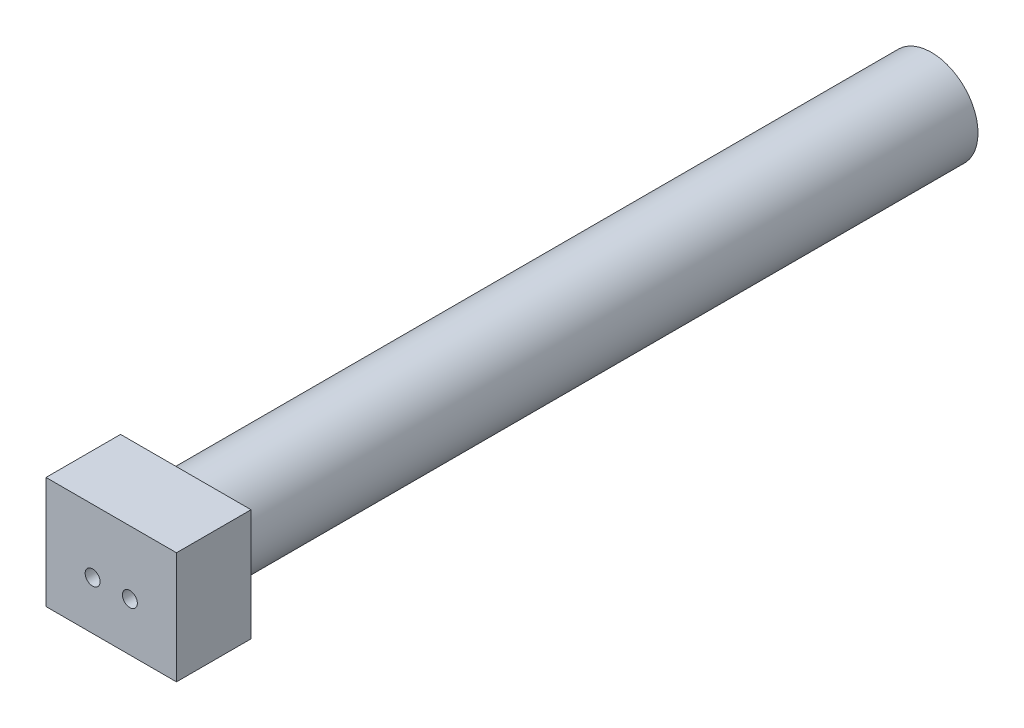
from build123d import *

# Parameters (mm, degrees)
ESQUISSE1_R             = 12.5
ESQUISSE1_R_2           = 8
BOSS_EXTRU_1_DEPTH      = 200
ESQUISSE2_W             = 35
ESQUISSE2_H             = 30
BOSS_EXTRU_2_DEPTH      = 20
ESQUISSE3_R             = 2
ENL_V_MAT_EXTRU_1_DEPTH = 20


with BuildPart() as part:
    # Esquisse1 → Boss.-Extru.1 (new body)
    with BuildSketch(Plane.XY):
        Circle(ESQUISSE1_R)
        Circle(ESQUISSE1_R_2, mode=Mode.SUBTRACT)
    extrude(amount=BOSS_EXTRU_1_DEPTH)

    # Esquisse2 → Boss.-Extru.2 (add)
    with BuildSketch(Plane.XY.offset(200)):
        Rectangle(ESQUISSE2_W, ESQUISSE2_H)
    extrude(amount=BOSS_EXTRU_2_DEPTH)

    # Esquisse3 → Enlèv. mat.-Extru.1 (cut)
    with BuildSketch(Plane.XY.offset(220)):
        with Locations((5, -2)):
            Circle(ESQUISSE3_R)
        with Locations((-5, -2)):
            Circle(ESQUISSE3_R)
    extrude(amount=-ENL_V_MAT_EXTRU_1_DEPTH, mode=Mode.SUBTRACT)


solid = part.part
